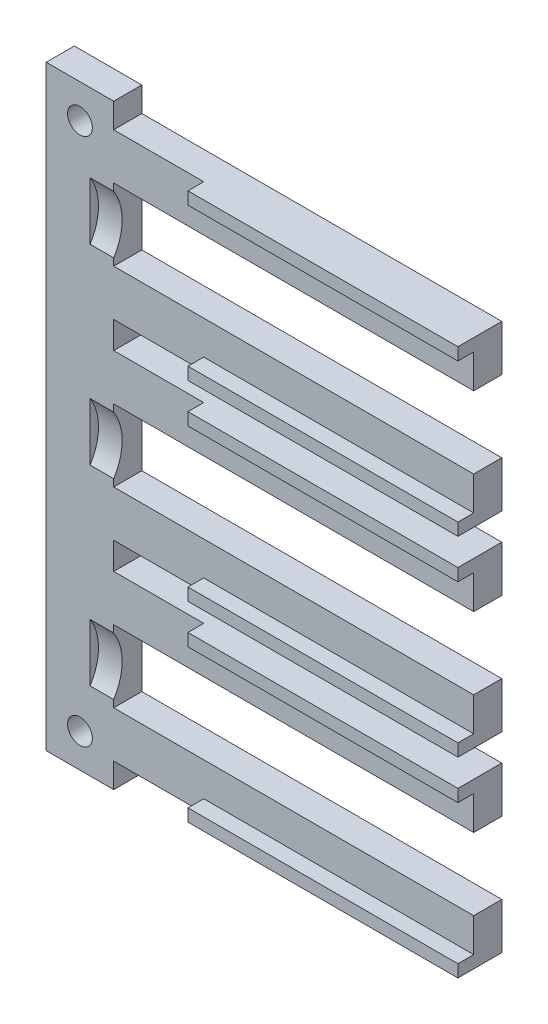
from build123d import *

# Parameters (mm, degrees)
FRONT_GRIP_ACETAL_GUIDE_COMB_SKETCH_W  = 6
FRONT_GRIP_ACETAL_GUIDE_COMB_SKETCH_H  = 53
FRONT_GRIP_ACETAL_GUIDE_COMB_DEPTH     = 2.5
GRIP_GUIDE_LEDGE_1_LOWER_SKETCH_W      = 32.1
GRIP_GUIDE_LEDGE_1_LOWER_SKETCH_H      = 4.1
GRIP_GUIDE_LEDGE_1_LOWER_DEPTH         = 2.5
GRIP_GUIDE_LEDGE_1_UPPER_SKETCH_W      = 32.1
GRIP_GUIDE_LEDGE_1_UPPER_SKETCH_H      = 4.1
GRIP_GUIDE_LEDGE_1_UPPER_DEPTH         = 2.5
GRIP_GUIDE_FENCE_1_LOWER_SKETCH_W      = 24
GRIP_GUIDE_FENCE_1_LOWER_SKETCH_H      = 1.1
GRIP_GUIDE_FENCE_1_LOWER_DEPTH         = 1.5
GRIP_GUIDE_FENCE_1_UPPER_SKETCH_W      = 24
GRIP_GUIDE_FENCE_1_UPPER_SKETCH_H      = 1.1
GRIP_GUIDE_FENCE_1_UPPER_DEPTH         = 1.5
GRIP_GUIDE_LEDGE_2_LOWER_SKETCH_W      = 32.1
GRIP_GUIDE_LEDGE_2_LOWER_SKETCH_H      = 4.1
GRIP_GUIDE_LEDGE_2_LOWER_DEPTH         = 2.5
GRIP_GUIDE_LEDGE_2_UPPER_SKETCH_W      = 32.1
GRIP_GUIDE_LEDGE_2_UPPER_SKETCH_H      = 4.1
GRIP_GUIDE_LEDGE_2_UPPER_DEPTH         = 2.5
GRIP_GUIDE_FENCE_2_LOWER_SKETCH_W      = 24
GRIP_GUIDE_FENCE_2_LOWER_SKETCH_H      = 1.1
GRIP_GUIDE_FENCE_2_LOWER_DEPTH         = 1.5
GRIP_GUIDE_FENCE_2_UPPER_SKETCH_W      = 24
GRIP_GUIDE_FENCE_2_UPPER_SKETCH_H      = 1.1
GRIP_GUIDE_FENCE_2_UPPER_DEPTH         = 1.5
GRIP_GUIDE_LEDGE_3_LOWER_SKETCH_W      = 32.1
GRIP_GUIDE_LEDGE_3_LOWER_SKETCH_H      = 4.1
GRIP_GUIDE_LEDGE_3_LOWER_DEPTH         = 2.5
GRIP_GUIDE_LEDGE_3_UPPER_SKETCH_W      = 32.1
GRIP_GUIDE_LEDGE_3_UPPER_SKETCH_H      = 4.1
GRIP_GUIDE_LEDGE_3_UPPER_DEPTH         = 2.5
GRIP_GUIDE_FENCE_3_LOWER_SKETCH_W      = 24
GRIP_GUIDE_FENCE_3_LOWER_SKETCH_H      = 1.1
GRIP_GUIDE_FENCE_3_LOWER_DEPTH         = 1.5
GRIP_GUIDE_FENCE_3_UPPER_SKETCH_W      = 24
GRIP_GUIDE_FENCE_3_UPPER_SKETCH_H      = 1.1
GRIP_GUIDE_FENCE_3_UPPER_DEPTH         = 1.5
FRONT_GUIDE_SCREW_CLEARANCE_1_SKETCH_R = 1.1
FRONT_GUIDE_SCREW_CLEARANCE_1_DEPTH    = 2.7
FRONT_GUIDE_SCREW_CLEARANCE_2_SKETCH_R = 1.1
FRONT_GUIDE_SCREW_CLEARANCE_2_DEPTH    = 2.7
OUTLET_SEAT_CLEARANCE_1_SKETCH_R       = 4.75
OUTLET_SEAT_CLEARANCE_1_DEPTH          = 2.2
OUTLET_SEAT_CLEARANCE_2_SKETCH_R       = 4.75
OUTLET_SEAT_CLEARANCE_2_DEPTH          = 2.2
OUTLET_SEAT_CLEARANCE_3_SKETCH_R       = 4.75
OUTLET_SEAT_CLEARANCE_3_DEPTH          = 2.2


with BuildPart() as part:
    # Front Grip Acetal Guide Comb sketch → Front Grip Acetal Guide Comb (new body)
    with BuildSketch(Plane.XY.offset(8.5)):
        with Locations((-63.291651246, -29)):
            Rectangle(FRONT_GRIP_ACETAL_GUIDE_COMB_SKETCH_W, FRONT_GRIP_ACETAL_GUIDE_COMB_SKETCH_H)
    extrude(amount=FRONT_GRIP_ACETAL_GUIDE_COMB_DEPTH)

    # Grip Guide Ledge 1 Lower sketch → Grip Guide Ledge 1 Lower (add)
    with BuildSketch(Plane.XY.offset(8.5)):
        with Locations((-44.341651246, -6.75)):
            Rectangle(GRIP_GUIDE_LEDGE_1_LOWER_SKETCH_W, GRIP_GUIDE_LEDGE_1_LOWER_SKETCH_H)
    extrude(amount=GRIP_GUIDE_LEDGE_1_LOWER_DEPTH)

    # Grip Guide Ledge 1 Upper sketch → Grip Guide Ledge 1 Upper (add)
    with BuildSketch(Plane.XY.offset(8.5)):
        with Locations((-44.341651246, -17.25)):
            Rectangle(GRIP_GUIDE_LEDGE_1_UPPER_SKETCH_W, GRIP_GUIDE_LEDGE_1_UPPER_SKETCH_H)
    extrude(amount=GRIP_GUIDE_LEDGE_1_UPPER_DEPTH)

    # Grip Guide Fence 1 Lower sketch → Grip Guide Fence 1 Lower (add)
    with BuildSketch(Plane.XY.offset(10.9)):
        with Locations((-40.291651246, -5.25)):
            Rectangle(GRIP_GUIDE_FENCE_1_LOWER_SKETCH_W, GRIP_GUIDE_FENCE_1_LOWER_SKETCH_H)
    extrude(amount=GRIP_GUIDE_FENCE_1_LOWER_DEPTH)

    # Grip Guide Fence 1 Upper sketch → Grip Guide Fence 1 Upper (add)
    with BuildSketch(Plane.XY.offset(10.9)):
        with Locations((-40.291651246, -18.75)):
            Rectangle(GRIP_GUIDE_FENCE_1_UPPER_SKETCH_W, GRIP_GUIDE_FENCE_1_UPPER_SKETCH_H)
    extrude(amount=GRIP_GUIDE_FENCE_1_UPPER_DEPTH)

    # Grip Guide Ledge 2 Lower sketch → Grip Guide Ledge 2 Lower (add)
    with BuildSketch(Plane.XY.offset(8.5)):
        with Locations((-44.341651246, -23.75)):
            Rectangle(GRIP_GUIDE_LEDGE_2_LOWER_SKETCH_W, GRIP_GUIDE_LEDGE_2_LOWER_SKETCH_H)
    extrude(amount=GRIP_GUIDE_LEDGE_2_LOWER_DEPTH)

    # Grip Guide Ledge 2 Upper sketch → Grip Guide Ledge 2 Upper (add)
    with BuildSketch(Plane.XY.offset(8.5)):
        with Locations((-44.341651246, -34.25)):
            Rectangle(GRIP_GUIDE_LEDGE_2_UPPER_SKETCH_W, GRIP_GUIDE_LEDGE_2_UPPER_SKETCH_H)
    extrude(amount=GRIP_GUIDE_LEDGE_2_UPPER_DEPTH)

    # Grip Guide Fence 2 Lower sketch → Grip Guide Fence 2 Lower (add)
    with BuildSketch(Plane.XY.offset(10.9)):
        with Locations((-40.291651246, -22.25)):
            Rectangle(GRIP_GUIDE_FENCE_2_LOWER_SKETCH_W, GRIP_GUIDE_FENCE_2_LOWER_SKETCH_H)
    extrude(amount=GRIP_GUIDE_FENCE_2_LOWER_DEPTH)

    # Grip Guide Fence 2 Upper sketch → Grip Guide Fence 2 Upper (add)
    with BuildSketch(Plane.XY.offset(10.9)):
        with Locations((-40.291651246, -35.75)):
            Rectangle(GRIP_GUIDE_FENCE_2_UPPER_SKETCH_W, GRIP_GUIDE_FENCE_2_UPPER_SKETCH_H)
    extrude(amount=GRIP_GUIDE_FENCE_2_UPPER_DEPTH)

    # Grip Guide Ledge 3 Lower sketch → Grip Guide Ledge 3 Lower (add)
    with BuildSketch(Plane.XY.offset(8.5)):
        with Locations((-44.341651246, -40.75)):
            Rectangle(GRIP_GUIDE_LEDGE_3_LOWER_SKETCH_W, GRIP_GUIDE_LEDGE_3_LOWER_SKETCH_H)
    extrude(amount=GRIP_GUIDE_LEDGE_3_LOWER_DEPTH)

    # Grip Guide Ledge 3 Upper sketch → Grip Guide Ledge 3 Upper (add)
    with BuildSketch(Plane.XY.offset(8.5)):
        with Locations((-44.341651246, -51.25)):
            Rectangle(GRIP_GUIDE_LEDGE_3_UPPER_SKETCH_W, GRIP_GUIDE_LEDGE_3_UPPER_SKETCH_H)
    extrude(amount=GRIP_GUIDE_LEDGE_3_UPPER_DEPTH)

    # Grip Guide Fence 3 Lower sketch → Grip Guide Fence 3 Lower (add)
    with BuildSketch(Plane.XY.offset(10.9)):
        with Locations((-40.291651246, -39.25)):
            Rectangle(GRIP_GUIDE_FENCE_3_LOWER_SKETCH_W, GRIP_GUIDE_FENCE_3_LOWER_SKETCH_H)
    extrude(amount=GRIP_GUIDE_FENCE_3_LOWER_DEPTH)

    # Grip Guide Fence 3 Upper sketch → Grip Guide Fence 3 Upper (add)
    with BuildSketch(Plane.XY.offset(10.9)):
        with Locations((-40.291651246, -52.75)):
            Rectangle(GRIP_GUIDE_FENCE_3_UPPER_SKETCH_W, GRIP_GUIDE_FENCE_3_UPPER_SKETCH_H)
    extrude(amount=GRIP_GUIDE_FENCE_3_UPPER_DEPTH)

    # Front Guide Screw Clearance 1 sketch → Front Guide Screw Clearance 1 (cut)
    with BuildSketch(Plane.XY.offset(8.4)):
        with Locations(Location((-63.291651246, -5.5, 0), (0, 0, 180))):
            Circle(FRONT_GUIDE_SCREW_CLEARANCE_1_SKETCH_R)
    extrude(amount=FRONT_GUIDE_SCREW_CLEARANCE_1_DEPTH, mode=Mode.SUBTRACT)

    # Front Guide Screw Clearance 2 sketch → Front Guide Screw Clearance 2 (cut)
    with BuildSketch(Plane.XY.offset(8.4)):
        with Locations(Location((-63.291651246, -52.5, 0), (0, 0, 180))):
            Circle(FRONT_GUIDE_SCREW_CLEARANCE_2_SKETCH_R)
    extrude(amount=FRONT_GUIDE_SCREW_CLEARANCE_2_DEPTH, mode=Mode.SUBTRACT)

    # Outlet seat clearance 1 sketch → Outlet seat clearance 1 (cut)
    with BuildSketch(Plane(origin=(-62.391651246, 0, 0), x_dir=(0, 0, -1), z_dir=(1, 0, 0))):
        with Locations((-15, -12)):
            Circle(OUTLET_SEAT_CLEARANCE_1_SKETCH_R)
    extrude(amount=OUTLET_SEAT_CLEARANCE_1_DEPTH, mode=Mode.SUBTRACT)

    # Outlet seat clearance 2 sketch → Outlet seat clearance 2 (cut)
    with BuildSketch(Plane(origin=(-62.391651246, 0, 0), x_dir=(0, 0, -1), z_dir=(1, 0, 0))):
        with Locations((-15, -29)):
            Circle(OUTLET_SEAT_CLEARANCE_2_SKETCH_R)
    extrude(amount=OUTLET_SEAT_CLEARANCE_2_DEPTH, mode=Mode.SUBTRACT)

    # Outlet seat clearance 3 sketch → Outlet seat clearance 3 (cut)
    with BuildSketch(Plane(origin=(-62.391651246, 0, 0), x_dir=(0, 0, -1), z_dir=(1, 0, 0))):
        with Locations((-15, -46)):
            Circle(OUTLET_SEAT_CLEARANCE_3_SKETCH_R)
    extrude(amount=OUTLET_SEAT_CLEARANCE_3_DEPTH, mode=Mode.SUBTRACT)


with BuildPart() as body_2:
    # Mirror1: mirrored copy
    add(part.part.mirror(Plane(origin=(0, 0, 0), x_dir=(0, 0, 1), z_dir=(0, -1, 0))))


solid = body_2.part
